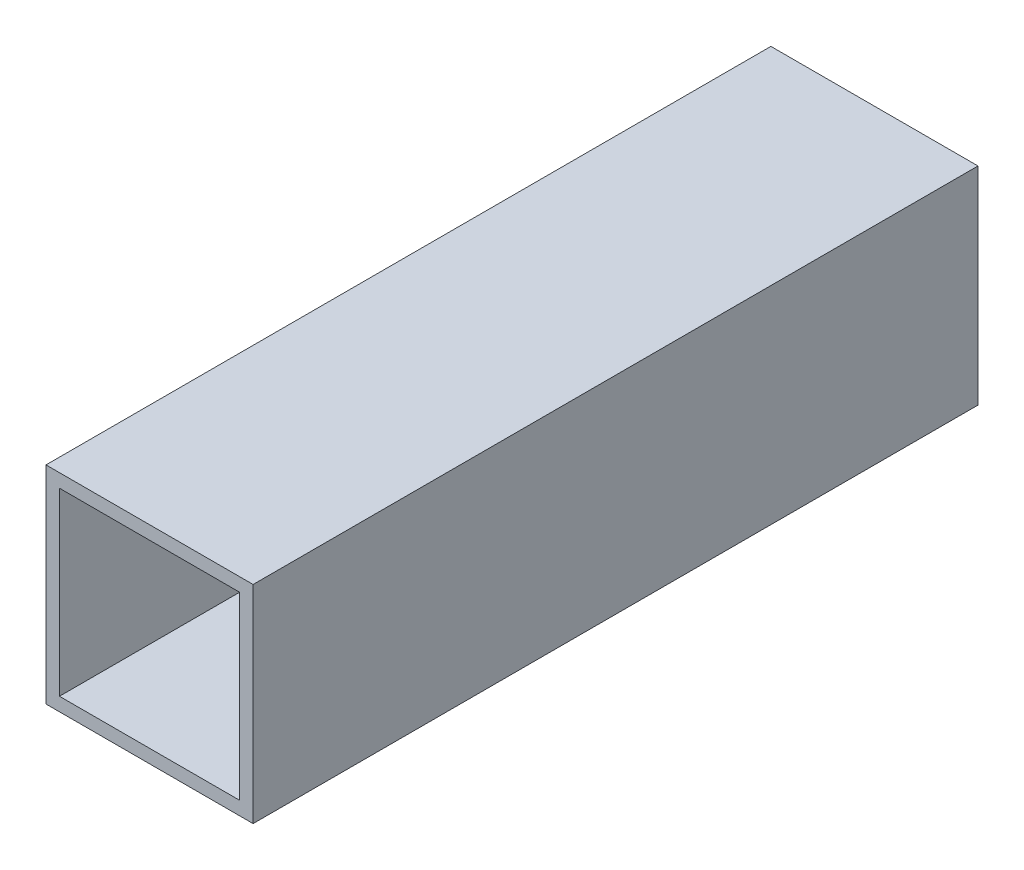
from build123d import *

# Parameters (mm, degrees)
SKETCH1_W           = 25.4
SKETCH1_H           = 25.4
BOSS_EXTRUDE1_DEPTH = 88.9
SKETCH2_W           = 22.098
SKETCH2_H           = 22.098
CUT_EXTRUDE1_DEPTH  = 113.236794529


with BuildPart() as part:
    # Sketch1 → Boss-Extrude1 (new body)
    with BuildSketch(Plane.XY):
        with Locations((-45.807586207, -22.947586207)):
            Rectangle(SKETCH1_W, SKETCH1_H)
    extrude(amount=BOSS_EXTRUDE1_DEPTH)

    # Sketch2 → Cut-Extrude1 (cut, through all)
    with BuildSketch(Plane.XY.offset(88.9)):
        with Locations((-45.807586207, -22.947586207)):
            Rectangle(SKETCH2_W, SKETCH2_H)
    extrude(amount=-CUT_EXTRUDE1_DEPTH, mode=Mode.SUBTRACT)


solid = part.part
